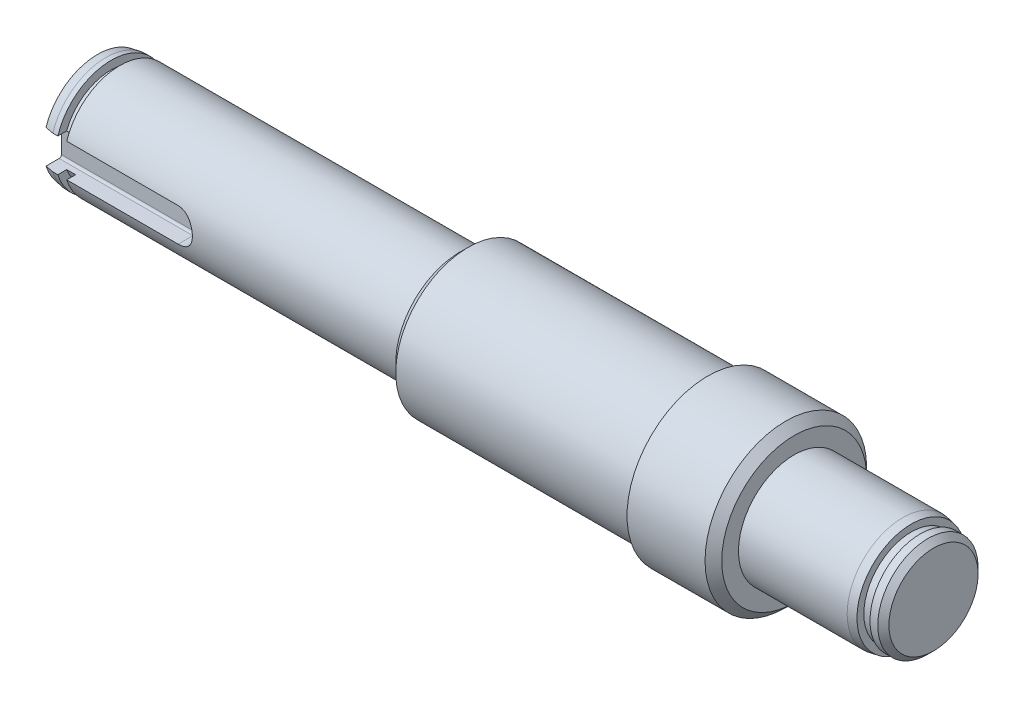
from build123d import *

# Parameters (mm, degrees)
CHAMFER_1_SIZE              = 1.5
CHAMFER_1_SIZE2             = 0.264490471
CHAMFER_2_SIZE              = 1
SKETCH_2_W                  = 1.6
SKETCH_2_H                  = 2.408745076
SKETCH_6_R                  = 10
EXTRUDE_2_DEPTH             = 42.4
EXTRUDE_2_DIRECTION_2_REACH = 111.159
CHAMFER_5_SIZE              = 1.5
CHAMFER_5_SIZE2             = 0.264490471
CUT_EXTRUDE_2_DEPTH         = 3.5
CHAMFER_6_SIZE              = 1.5
EXTRUDE_START               = -15.5
SKETCH_9_R                  = 14.5
SKETCH_9_R_2                = 13
EXTRUDE_3_DEPTH             = 15.5
CHAMFER_7_SIZE              = 1.5
FILLET_1_R                  = 0.4


with BuildPart() as part:
    # Эскиз1 → Повернуть1 (revolve)
    with BuildSketch(Plane.XY, mode=Mode.PRIVATE) as revolve_1_sk:
        Polygon((0, 0), (0, 13), (30, 13), (30, 10), (51, 10), (51, 9), (55, 9), (55, 0), align=None)
    revolve(revolve_1_sk.sketch.rotate(Axis((0, 0, 0), (1, 0, 0)), 90), axis=Axis((0, 0, 0), (1, 0, 0)))

    # Зеркальное отражение1: part across plane


with BuildPart() as part_1:
    add(part.part)
    add(part.part.mirror(Plane(origin=(0, 0, 0), x_dir=(0, 0, 1), z_dir=(1, 0, 0))))

    # Фаска1
    chamfer_1_edges = [part_1.edges().sort_by_distance(p)[0] for p in [
        (51, 0, -10),
    ]]
    chamfer_1_side = [part_1.faces().sort_by_distance(p)[0] for p in [
        (40.5, 0, -10),
    ]]
    chamfer(chamfer_1_edges, length=CHAMFER_1_SIZE, length2=CHAMFER_1_SIZE2, reference=chamfer_1_side[0])

    # Фаска2
    chamfer_2_edges = [part_1.edges().sort_by_distance(p)[0] for p in [
        (55, 0, -9),
    ]]
    chamfer(chamfer_2_edges, length=CHAMFER_2_SIZE)

    # Эскиз2 → Вырез-Повернуть1 (revolve, cut)
    with BuildSketch(Plane(origin=(0, 0, 0), x_dir=(1, 0, 0), z_dir=(0, 1, 0)), mode=Mode.PRIVATE) as cut_revolve_1_sk:
        with Locations((51.8, 9.704372538)):
            Rectangle(SKETCH_2_W, SKETCH_2_H)
    cut_revolve_1 = revolve(cut_revolve_1_sk.sketch.rotate(Axis((0, 0, 0), (1, 0, 0)), 180), axis=Axis((0, 0, 0), (1, 0, 0)), mode=Mode.SUBTRACT)

    # Зеркальное отражение2: Вырез-Повернуть1 across plane
    add(cut_revolve_1.mirror(Plane(origin=(0, 0, 0), x_dir=(0, 0, 1), z_dir=(1, 0, 0))), mode=Mode.SUBTRACT)

    # Эскиз6 → Бобышка-Вытянуть2 (add)
    with BuildSketch(Plane(origin=(-52.6, 0, 0), x_dir=(0, 0, -1), z_dir=(1, 0, 0))):
        with Locations(Location((0, 0, 0), (0, 0, 180))):
            Circle(SKETCH_6_R)
    extrude(amount=-EXTRUDE_2_DEPTH)

    # Эскиз6 → Бобышка-Вытянуть2 direction 2 (add, up to next)
    with BuildSketch(Plane(origin=(-52.6, 0, 0), x_dir=(0, 0, -1), z_dir=(1, 0, 0)), mode=Mode.PRIVATE) as extrude_2_direction_2_sk1:
        with Locations(Location((0, 0, 0), (0, 0, 180))):
            Circle(SKETCH_6_R)
    extrude_2_direction_2_tool1 = extrude(extrude_2_direction_2_sk1.sketch, amount=EXTRUDE_2_DIRECTION_2_REACH, mode=Mode.PRIVATE) - part_1.part
    add(extrude_2_direction_2_tool1.solids().sort_by_distance((-52.6, 0, 0))[0])

    # Фаска5
    chamfer_5_edges = [part_1.edges().sort_by_distance(p)[0] for p in [
        (-95, 0, -10),
    ]]
    chamfer_5_side = [part_1.faces().sort_by_distance(p)[0] for p in [
        (-73.8, 0, -10),
    ]]
    chamfer(chamfer_5_edges, length=CHAMFER_5_SIZE, length2=CHAMFER_5_SIZE2, reference=chamfer_5_side[0])

    # Зеркальное отражение5: Вырез-Повернуть1 across plane
    add(cut_revolve_1.mirror(Plane(origin=(-20, 0, 0), x_dir=(0, 0, 1), z_dir=(1, 0, 0))), mode=Mode.SUBTRACT)

    # Эскиз8 → Вырез-Вытянуть2 (cut)
    with BuildSketch(Plane.XY.offset(10)):
        with BuildLine():
            Line((-119, 3), (-71, 3))
            ThreePointArc((-71, 3), (-68, 0), (-71, -3))
            Line((-71, -3), (-119, -3))
            ThreePointArc((-119, -3), (-122, 0), (-119, 3))
        make_face()
    extrude(amount=-CUT_EXTRUDE_2_DEPTH, mode=Mode.SUBTRACT)

    # Фаска6
    chamfer_6_edges = [part_1.edges().sort_by_distance(p)[0] for p in [
        (-30, 0, -13),
    ]]
    chamfer(chamfer_6_edges, length=CHAMFER_6_SIZE)

    # Эскиз9 → Бобышка-Вытянуть3 (add)
    with BuildSketch(Plane(origin=(30, 0, 0), x_dir=(0, 0, -1), z_dir=(1, 0, 0)).offset(EXTRUDE_START)):
        Circle(SKETCH_9_R)
        Circle(SKETCH_9_R_2, mode=Mode.SUBTRACT)
    extrude(amount=EXTRUDE_3_DEPTH)

    # Фаска7
    chamfer_7_edges = [part_1.edges().sort_by_distance(p)[0] for p in [
        (30, 0, 14.5),
    ]]
    chamfer(chamfer_7_edges, length=CHAMFER_7_SIZE)

    # Скругление1
    fillet_1_edges = [part_1.edges().sort_by_distance(p)[0] for p in [
        (-68, 0, 6.5),
        (-83, 3, 6.5),
        (-83, -3, 6.5),
    ]]
    fillet(fillet_1_edges, radius=FILLET_1_R)


solid = part_1.part
